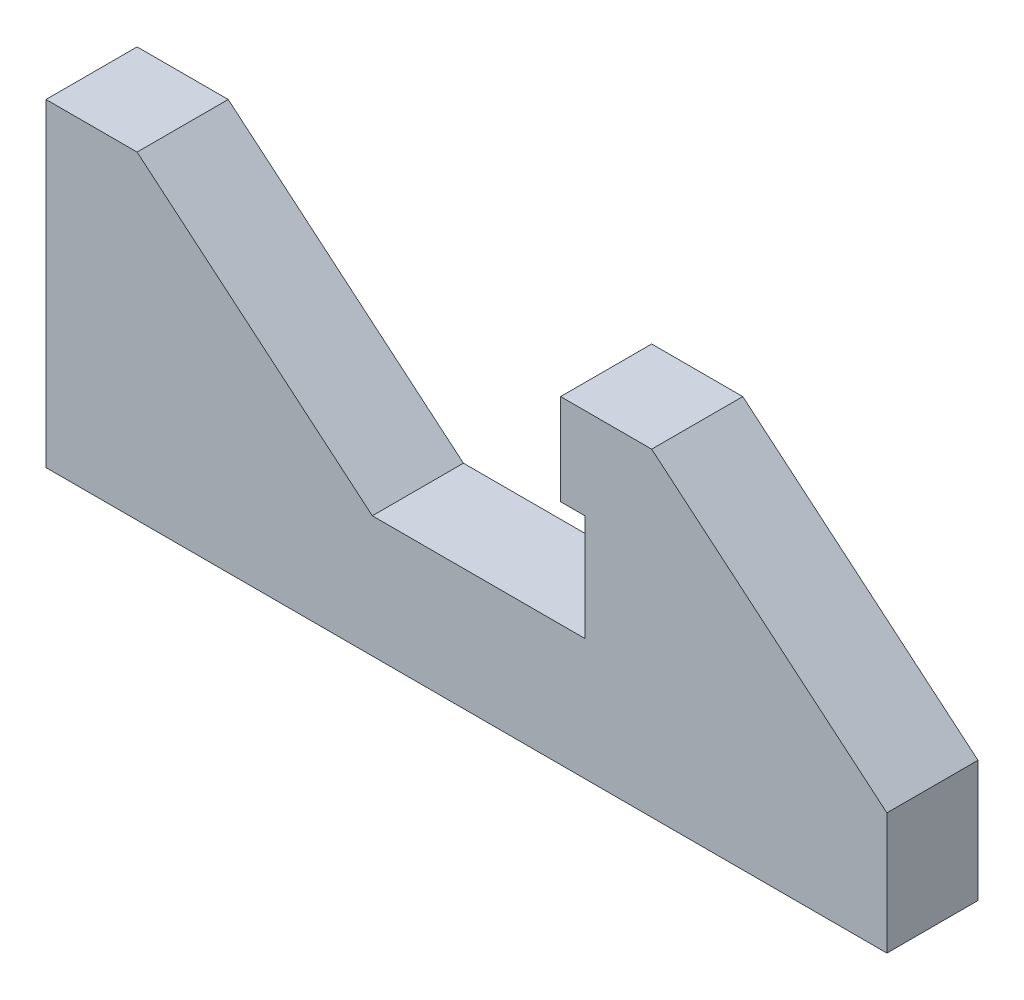
from build123d import *

# Parameters (mm, degrees)
BOSS_EXTRUDE1_DEPTH = 30


with BuildPart() as part:
    # Sketch1 → Boss-Extrude1 (new body)
    with BuildSketch(Plane.XY):
        Polygon((0, 0), (0, 105), (30, 105), (107.463983519, 40), (177.463983519, 40), (177.463983519, 75), (169.463983519, 75), (169.463983519, 105), (199.463983519, 105), (276.927967037, 40), (276.927967037, 0), align=None)
    extrude(amount=BOSS_EXTRUDE1_DEPTH)


solid = part.part
